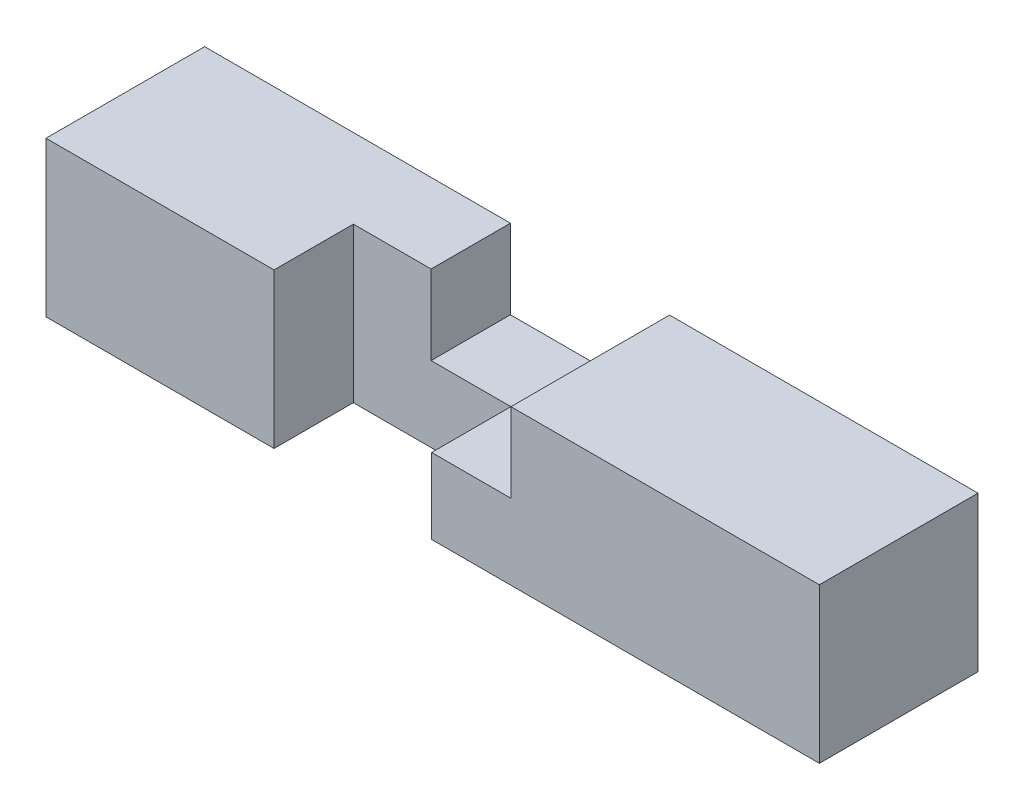
from build123d import *

# Parameters (mm, degrees)
SKETCH_1_W           = 97.5
SKETCH_1_H           = 19.5
EXTRUDE_1_DEPTH      = 20
SKETCH_2_W           = 29.8652771
SKETCH_2_H           = 10
CUT_EXTRUDE_4_DEPTH  = 29
SKETCH_3_W           = 10
SKETCH_3_H           = 10
CUT_EXTRUDE_5_DEPTH  = 10
SKETCH_4_W           = 19.8652771
SKETCH_4_H           = 10
CUT_EXTRUDE_6_DEPTH  = 10
SKETCH_5_W           = 10
SKETCH_5_H           = 10
CUT_EXTRUDE_7_DEPTH  = 10
SHELL_1_T            = -2
SKETCH_7_W           = 10
SKETCH_7_H           = 10
CUT_EXTRUDE_8_DEPTH  = 10
SKETCH_8_W           = 10.001998353
SKETCH_8_H           = 10
CUT_EXTRUDE_9_DEPTH  = 10
SKETCH_9_W           = 10
SKETCH_9_H           = 10
EXTRUDE_3_DEPTH      = 10
SKETCH_10_W          = 8.5
SKETCH_10_H          = 8.69149108
EXTRUDE_4_DEPTH      = 0.5
SKETCH_11_W          = 8
SKETCH_11_H          = 8
EXTRUDE_5_DEPTH      = 0.5
SKETCH_15_W          = 10.5
SKETCH_15_H          = 0.69149108
EXTRUDE_18_DEPTH     = 9.5
SKETCH_18_W          = 8
SKETCH_18_H          = 8
EXTRUDE_22_DEPTH     = 0.5
SKETCH_21_W          = 10
SKETCH_21_H          = 0.094242597
EXTRUDE_25_DEPTH     = 10.5
SKETCH_23_W          = 20
SKETCH_23_H          = 10
EXTRUDE_27_DEPTH     = 10
SKETCH_24_W          = 10.001998353
SKETCH_24_H          = 10
EXTRUDE_28_DEPTH     = 10
SKETCH_25_W          = 9.8
SKETCH_25_H          = 10
EXTRUDE_29_DEPTH     = 10
SKETCH_31_W          = 10
SKETCH_31_H          = 0.5
CUT_EXTRUDE_11_DEPTH = 11.5
SKETCH_32_W          = 16
SKETCH_32_H          = 15.5
EXTRUDE_43_DEPTH     = 0.5


with BuildPart() as part:
    # 草圖1 → 填料-伸長1 (new body)
    with BuildSketch(Plane.XY):
        Rectangle(SKETCH_1_W, SKETCH_1_H)
    extrude(amount=EXTRUDE_1_DEPTH)

    # 草圖2 → 除料-伸長4 (cut)
    with BuildSketch(Plane(origin=(0, 9.75, 0), x_dir=(1, 0, 0), z_dir=(0, 1, 0))):
        with Locations((-5.06736145, -15)):
            Rectangle(SKETCH_2_W, SKETCH_2_H)
    extrude(amount=-CUT_EXTRUDE_4_DEPTH, mode=Mode.SUBTRACT)

    # 草圖3 → 除料-伸長5 (cut)
    with BuildSketch(Plane(origin=(0, 9.75, 0), x_dir=(1, 0, 0), z_dir=(0, 1, 0))):
        with Locations((14.8652771, -15)):
            Rectangle(SKETCH_3_W, SKETCH_3_H)
    extrude(amount=-CUT_EXTRUDE_5_DEPTH, mode=Mode.SUBTRACT)

    # 草圖4 → 除料-伸長6 (cut)
    with BuildSketch(Plane(origin=(0, 9.75, 0), x_dir=(1, 0, 0), z_dir=(0, 1, 0))):
        with Locations((9.93263855, -5)):
            Rectangle(SKETCH_4_W, SKETCH_4_H)
    extrude(amount=-CUT_EXTRUDE_6_DEPTH, mode=Mode.SUBTRACT)

    # 草圖5 → 除料-伸長7 (cut)
    with BuildSketch(Plane(origin=(0, 9.75, 0), x_dir=(1, 0, 0), z_dir=(0, 1, 0))):
        with Locations((-5, -5)):
            Rectangle(SKETCH_5_W, SKETCH_5_H)
    extrude(amount=-CUT_EXTRUDE_7_DEPTH, mode=Mode.SUBTRACT)

    # 薄殼1
    shell_1_openings = [part.faces().sort_by_distance(p)[0] for p in [
        (48.75, 0, 10),
    ]]
    offset(amount=SHELL_1_T, openings=shell_1_openings, kind=Kind.INTERSECTION)

    # 草圖7 → 除料-伸長8 (cut)
    with BuildSketch(Plane(origin=(0, 9.75, 0), x_dir=(1, 0, 0), z_dir=(0, 1, 0))):
        with Locations((-15, -5)):
            Rectangle(SKETCH_7_W, SKETCH_7_H)
    extrude(amount=-CUT_EXTRUDE_8_DEPTH, mode=Mode.SUBTRACT)

    # 草圖8 → 除料-伸長9 (cut)
    with BuildSketch(Plane(origin=(0, 9.75, 0), x_dir=(1, 0, 0), z_dir=(0, 1, 0))):
        with Locations((-25.000999177, -15)):
            Rectangle(SKETCH_8_W, SKETCH_8_H)
    extrude(amount=-CUT_EXTRUDE_9_DEPTH, mode=Mode.SUBTRACT)

    # 草圖9 → 填料-伸長3 (add)
    with BuildSketch(Plane(origin=(0, -0.25, 0), x_dir=(1, 0, 0), z_dir=(0, 1, 0))):
        with Locations((4.8652771, -15)):
            Rectangle(SKETCH_9_W, SKETCH_9_H)
    extrude(amount=-EXTRUDE_3_DEPTH)

    # 草圖10 → 填料-伸長4 (add)
    with BuildSketch(Plane(origin=(0, -0.25, 0), x_dir=(1, 0, 0), z_dir=(0, 1, 0))):
        with Locations((-26.25, -13.65425446)):
            Rectangle(SKETCH_10_W, SKETCH_10_H)
    extrude(amount=-EXTRUDE_4_DEPTH)

    # 草圖11 → 填料-伸長5 (add)
    with BuildSketch(Plane(origin=(-30.001998353, 0, 0), x_dir=(0, 0, -1), z_dir=(1, 0, 0))):
        with Locations((-14, 3.75)):
            Rectangle(SKETCH_11_W, SKETCH_11_H)
    extrude(amount=-EXTRUDE_5_DEPTH)

    # 草圖15 → 填料-伸長18 (add)
    with BuildSketch(Plane(origin=(0, -0.25, 0), x_dir=(1, 0, 0), z_dir=(0, 1, 0))):
        with Locations((-25.25, -9.65425446)):
            Rectangle(SKETCH_15_W, SKETCH_15_H)
    extrude(amount=EXTRUDE_18_DEPTH)

    # 草圖18 → 填料-伸長22 (add)
    with BuildSketch(Plane(origin=(0, -0.25, 0), x_dir=(1, 0, 0), z_dir=(0, 1, 0))):
        with Locations((-16, -6)):
            Rectangle(SKETCH_18_W, SKETCH_18_H)
    extrude(amount=-EXTRUDE_22_DEPTH)

    # 草圖21 → 填料-伸長25 (add)
    with BuildSketch(Plane(origin=(-20, 0, 0), x_dir=(0, 0, -1), z_dir=(1, 0, 0))):
        with Locations((-5, -0.297121299)):
            Rectangle(SKETCH_21_W, SKETCH_21_H)
    extrude(amount=EXTRUDE_25_DEPTH)

    # 草圖23 → 填料-伸長27 (add)
    with BuildSketch(Plane.ZY.offset(-19.8652771)):
        with Locations((10, 4.75)):
            Rectangle(SKETCH_23_W, SKETCH_23_H)
    extrude(amount=EXTRUDE_27_DEPTH)

    # 草圖24 → 填料-伸長28 (add)
    with BuildSketch(Plane(origin=(0, -0.25, 0), x_dir=(1, 0, 0), z_dir=(0, 1, 0))):
        with Locations((-25.000999177, -15)):
            Rectangle(SKETCH_24_W, SKETCH_24_H)
    extrude(amount=EXTRUDE_28_DEPTH)

    # 草圖25 → 填料-伸長29 (add)
    with BuildSketch(Plane(origin=(0, -0.25, 0), x_dir=(1, 0, 0), z_dir=(0, 1, 0))):
        with Locations((-15.1, -5)):
            Rectangle(SKETCH_25_W, SKETCH_25_H)
    extrude(amount=EXTRUDE_29_DEPTH)

    # 草圖31 → 除料-伸長11 (cut)
    with BuildSketch(Plane(origin=(9.8652771, 0, 0), x_dir=(0, 0, -1), z_dir=(1, 0, 0))):
        with Locations((-15, -10)):
            Rectangle(SKETCH_31_W, SKETCH_31_H)
    extrude(amount=-CUT_EXTRUDE_11_DEPTH, mode=Mode.SUBTRACT)

    # 草圖32 → 填料-伸長43 (add)
    with BuildSketch(Plane(origin=(48.75, 0, 0), x_dir=(0, 0, -1), z_dir=(1, 0, 0))):
        with Locations((-10, 0)):
            Rectangle(SKETCH_32_W, SKETCH_32_H)
    extrude(amount=-EXTRUDE_43_DEPTH)


solid = part.part
